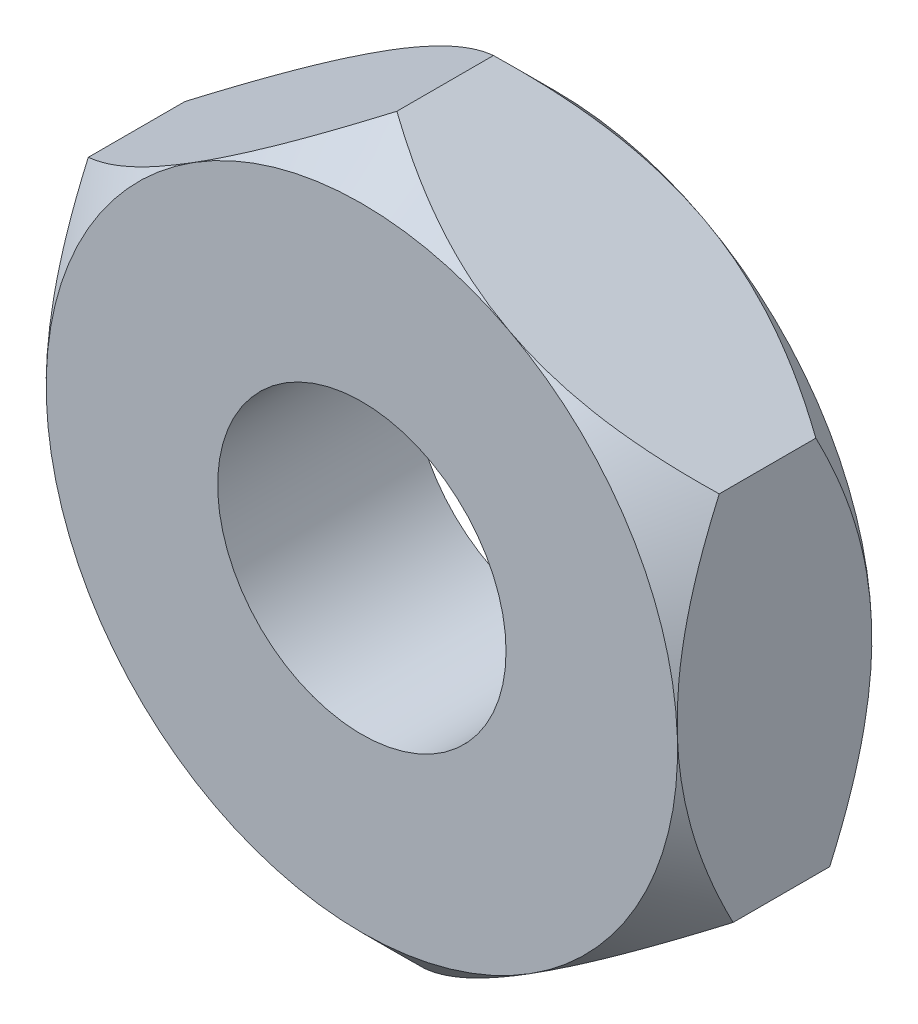
from build123d import *

# Parameters (mm, degrees)
SKETCH1_R               = 4.75
BOSS_EXTRUDE1_DEPTH     = 3.2
SKETCH2_OUTSIDE_W       = 42.576
SKETCH2_OUTSIDE_H       = 45.336
SKETCH2_OUTSIDE_R       = 10.39980339
CUT_EXTRUDE1_DEPTH      = 6.4
CUT_EXTRUDE1_DRAFT      = -45
MIRROR1_COPY_1_SKETCH_W = 42.576
MIRROR1_COPY_1_SKETCH_H = 45.336
MIRROR1_COPY_1_SKETCH_R = 10.39980339
MIRROR1_COPY_1_DEPTH    = 6.4
MIRROR1_COPY_1_DRAFT    = -45


with BuildPart() as part:
    # Sketch1 → Boss-Extrude1 (new, symmetric)
    with BuildSketch(Plane.XY):
        Polygon((10.620274545, -5.605144899), (10.164335146, 6.394855101), (-0.455939398, 12), (-10.620274545, 5.605144899), (-10.164335146, -6.394855101), (0.455939398, -12), align=None)
        Circle(SKETCH1_R, mode=Mode.SUBTRACT)
    extrude(amount=BOSS_EXTRUDE1_DEPTH, both=True)


with BuildPart() as cut_extrude1_tool:
    # Sketch2 outside → Cut-Extrude1 (with draft: the straight prism first)
    with BuildSketch(Plane.XY.offset(3.2)):
        Rectangle(SKETCH2_OUTSIDE_W, SKETCH2_OUTSIDE_H)
        Circle(SKETCH2_OUTSIDE_R, mode=Mode.SUBTRACT)
    extrude(amount=-CUT_EXTRUDE1_DEPTH)
    # Cut-Extrude1: the draft: its side faces are tilted about the plane it starts from
    cut_extrude1_sides = [cut_extrude1_tool.faces().sort_by_distance(p)[0] for p in [
        (0, -22.668, 0),
        (21.288, 0, 0),
        (0, 22.668, 0),
        (-21.288, 0, 0),
        (-10.39980339, 0, 0),
    ]]
    draft(cut_extrude1_sides, Plane.XY.offset(3.2), CUT_EXTRUDE1_DRAFT)


with BuildPart() as part_1:
    add(part.part)

    # Cut-Extrude1: cut by cut_extrude1_tool
    add(cut_extrude1_tool.part, mode=Mode.SUBTRACT)


with BuildPart() as mirror1_copy_1_tool:
    # Mirror1 copy 1 sketch → Mirror1 copy 1 (with draft: the straight prism first)
    with BuildSketch(Plane(origin=(0, 0, -3.2), x_dir=(1, 0, 0), z_dir=(0, 0, -1))):
        Rectangle(MIRROR1_COPY_1_SKETCH_W, MIRROR1_COPY_1_SKETCH_H)
        Circle(MIRROR1_COPY_1_SKETCH_R, mode=Mode.SUBTRACT)
    extrude(amount=-MIRROR1_COPY_1_DEPTH)
    # Mirror1 copy 1: the draft: its side faces are tilted about the plane it starts from
    mirror1_copy_1_sides = [mirror1_copy_1_tool.faces().sort_by_distance(p)[0] for p in [
        (0, -22.668, 0),
        (21.288, 0, 0),
        (0, 22.668, 0),
        (-21.288, 0, 0),
        (-10.39980339, 0, 0),
    ]]
    draft(mirror1_copy_1_sides, Plane(origin=(0, 0, -3.2), x_dir=(1, 0, 0), z_dir=(0, 0, -1)), MIRROR1_COPY_1_DRAFT)


with BuildPart() as part_2:
    add(part_1.part)

    # Mirror1 copy 1: cut by mirror1_copy_1_tool
    add(mirror1_copy_1_tool.part, mode=Mode.SUBTRACT)


solid = part_2.part
